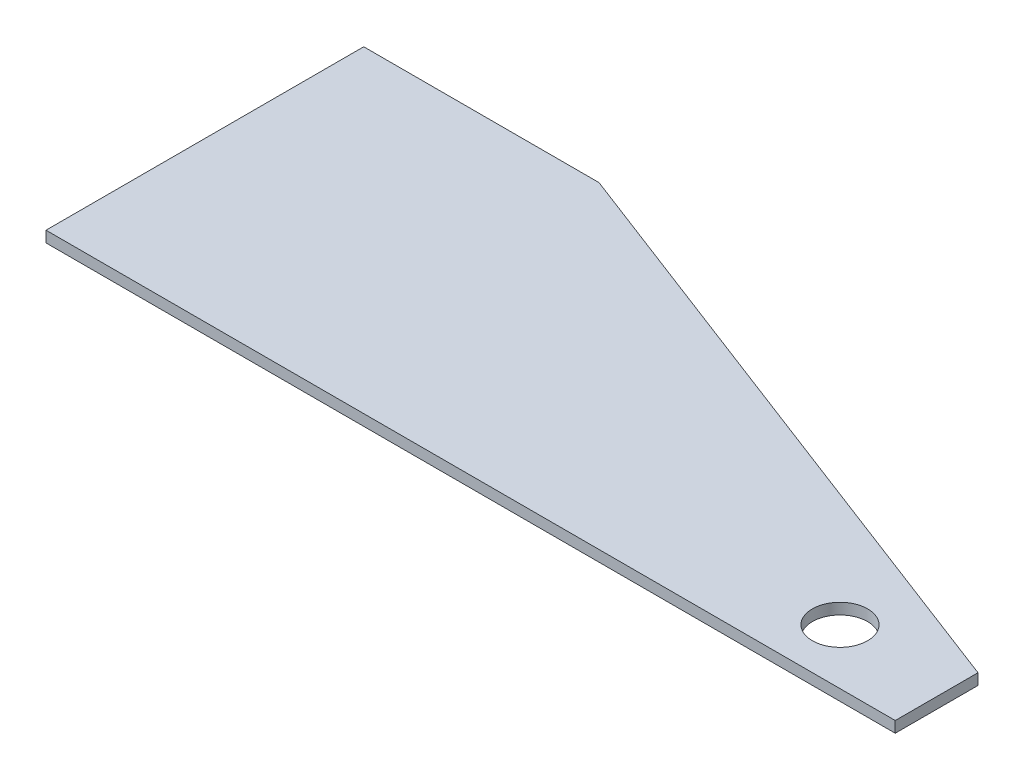
from build123d import *

# Parameters (mm, degrees)
BOSS_EXTRUDE1_DEPTH = 2
SKETCH2_R           = 5
CUT_EXTRUDE1_DEPTH  = 165.132919655


with BuildPart() as part:
    # Sketch1 → Boss-Extrude1 (new body)
    with BuildSketch(Plane(origin=(0, 0, 0), x_dir=(1, 0, 0), z_dir=(0, 1, 0))):
        Polygon((0, 0), (42.592528424, 0), (153.715208146, -42.529795372), (153.715208146, -57.508695855), (0, -57.508695855), align=None)
    extrude(amount=BOSS_EXTRUDE1_DEPTH)

    # Sketch2 → Cut-Extrude1 (cut, through all)
    with BuildSketch(Plane(origin=(0, 2, 0), x_dir=(1, 0, 0), z_dir=(0, 1, 0))):
        with Locations(Location((133.715208146, -47.508695855, 0), (0, 0, 270))):
            Circle(SKETCH2_R)
    extrude(amount=-CUT_EXTRUDE1_DEPTH, mode=Mode.SUBTRACT)


solid = part.part
